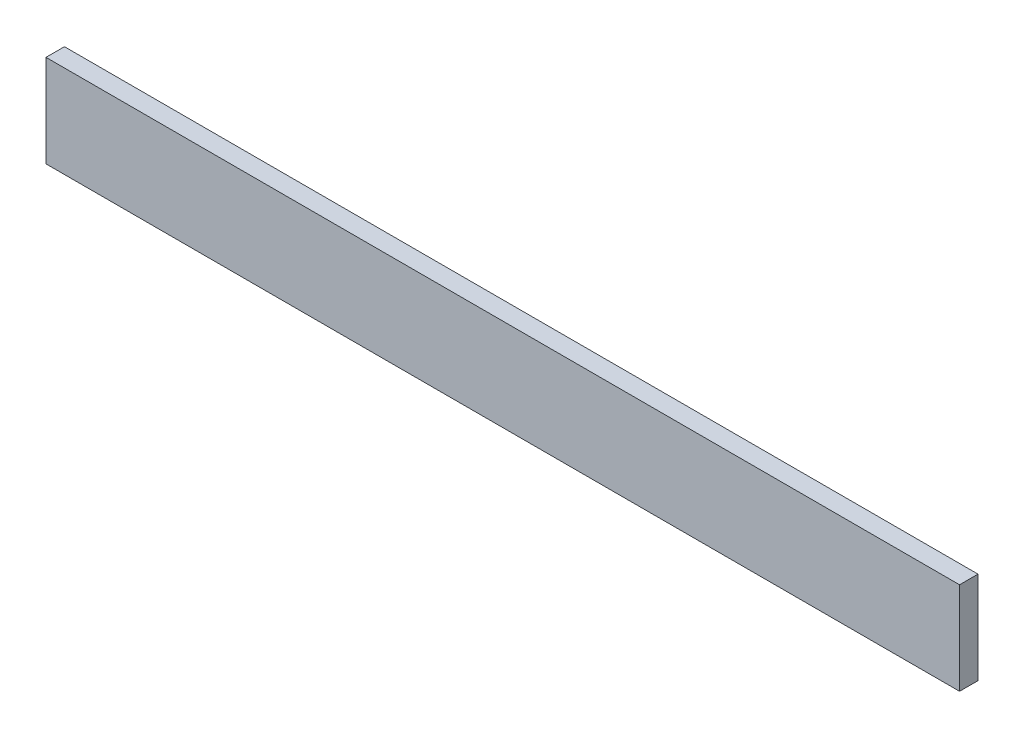
from build123d import *

# Parameters (mm, degrees)
SKETCH1_W           = 495
SKETCH1_H           = 50
BOSS_EXTRUDE1_DEPTH = 10


with BuildPart() as part:
    # Sketch1 → Boss-Extrude1 (new body)
    with BuildSketch(Plane.XY):
        with Locations((-0.350070721, 115.028288543)):
            Rectangle(SKETCH1_W, SKETCH1_H)
    extrude(amount=BOSS_EXTRUDE1_DEPTH)


solid = part.part
